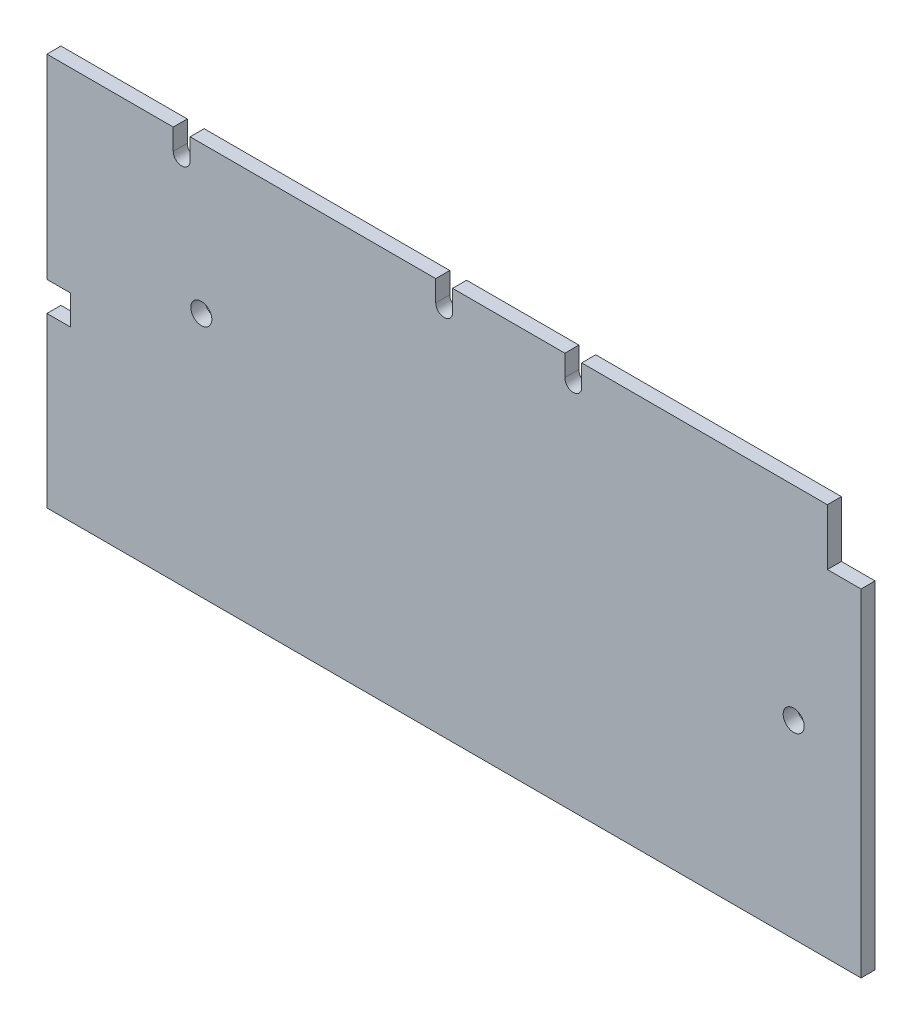
from build123d import *

# Parameters (mm, degrees)
SKETCH_1_R      = 0.75
EXTRUDE_1_DEPTH = 1


with BuildPart() as part:
    # Эскиз1 → Бобышка-Вытянуть1 (new body)
    with BuildSketch(Plane.XY):
        with BuildLine():
            Line((-13.546873489, 11.911067194), (-13.546873489, 13.411067194))
            Line((-13.546873489, 13.411067194), (-22.546873489, 13.411067194))
            Line((-22.546873489, 13.411067194), (-22.546873489, -0.488932806))
            Line((-22.546873489, -0.488932806), (-20.883119348, -0.488932806))
            Line((-20.883119348, -0.488932806), (-20.883119348, -2.588932806))
            Line((-20.883119348, -2.588932806), (-22.546873489, -2.588932806))
            Line((-22.546873489, -2.588932806), (-22.546873489, -14.588932806))
            Line((-22.546873489, -14.588932806), (35.453126511, -14.588932806))
            Line((35.453126511, -14.588932806), (35.453126511, 9.411067194))
            Line((35.453126511, 9.411067194), (33.053126511, 9.411067194))
            Line((33.053126511, 9.411067194), (33.053126511, 13.411067194))
            Line((33.053126511, 13.411067194), (15.553126511, 13.411067194))
            Line((15.553126511, 13.411067194), (15.553126511, 11.911067194))
            ThreePointArc((15.553126511, 11.911067194), (15.553472979, 11.899294703), (15.553588483, 11.887517681))
            ThreePointArc((15.553588483, 11.887517681), (14.94134949, 11.287171213), (14.353126511, 11.911067194))
            Line((14.353126511, 11.911067194), (14.353126511, 13.411067194))
            Line((14.353126511, 13.411067194), (6.353126511, 13.411067194))
            Line((6.353126511, 13.411067194), (6.353126511, 11.911067194))
            ThreePointArc((6.353126511, 11.911067194), (5.753126511, 11.311067194), (5.153126511, 11.911067194))
            Line((5.153126511, 11.911067194), (5.153126511, 13.411067194))
            Line((5.153126511, 13.411067194), (-12.346873489, 13.411067194))
            Line((-12.346873489, 13.411067194), (-12.346873489, 11.911067194))
            ThreePointArc((-12.346873489, 11.911067194), (-12.946873489, 11.311067194), (-13.546873489, 11.911067194))
        make_face()
        with Locations((30.653126511, -1.088932806)):
            Circle(SKETCH_1_R, mode=Mode.SUBTRACT)
        with Locations((-11.546873489, 2.911067194)):
            Circle(SKETCH_1_R, mode=Mode.SUBTRACT)
    extrude(amount=EXTRUDE_1_DEPTH)


solid = part.part
